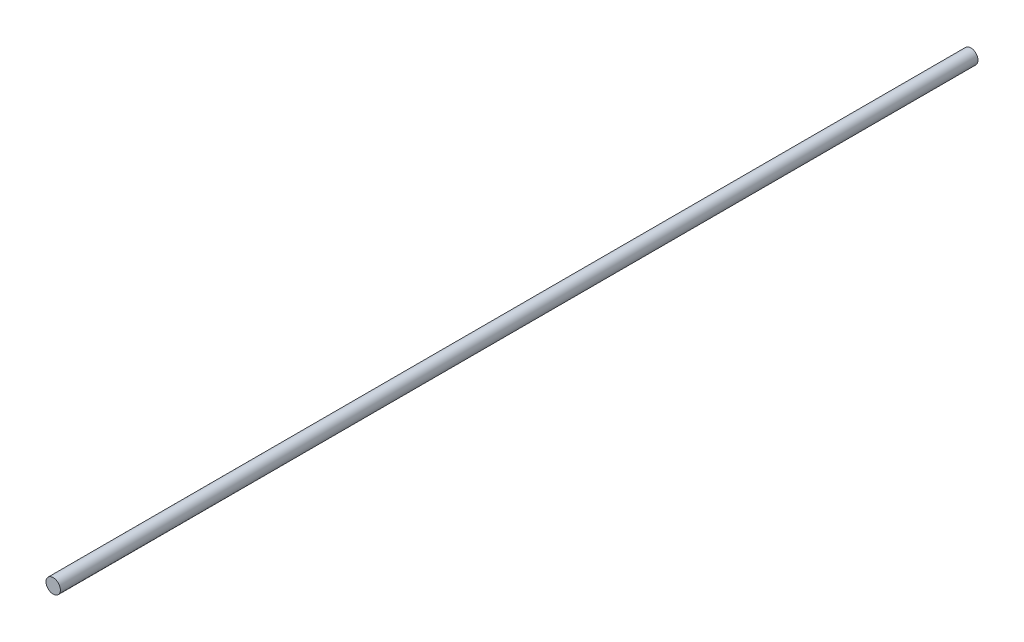
from build123d import *

# Parameters (mm, degrees)
ESQUISSE1_R        = 5
BOSS_EXTRU_1_DEPTH = 638


with BuildPart() as part:
    # Esquisse1 → Boss.-Extru.1 (new body)
    with BuildSketch(Plane.XY):
        Circle(ESQUISSE1_R)
    extrude(amount=BOSS_EXTRU_1_DEPTH)


solid = part.part
